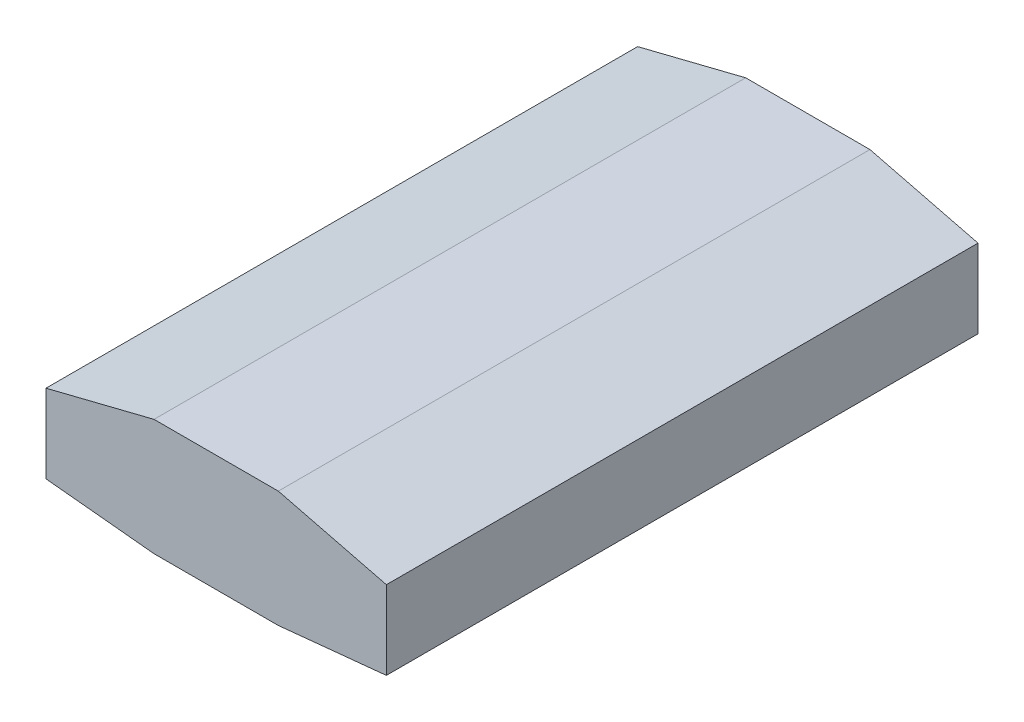
from build123d import *

# Parameters (mm, degrees)
SKETCH_1_W          = 63
SKETCH_1_H          = 21.54
EXTRUDE_1_DEPTH     = 109.5
CUT_EXTRUDE_1_DEPTH = 115.448647436
SKETCH_3_R          = 1
CUT_EXTRUDE_2_DEPTH = 5


with BuildPart() as part:
    # 草图1 → 凸台-拉伸1 (new body)
    with BuildSketch(Plane.XY):
        Rectangle(SKETCH_1_W, SKETCH_1_H)
    extrude(amount=EXTRUDE_1_DEPTH)

    # 草图2 → 切除-拉伸1 (cut, through all)
    with BuildSketch(Plane.XY.offset(109.5)):
        Polygon((11.5, 10.77), (31.5, 5.77), (31.5, 10.77), align=None)
        Polygon((-31.5, 10.77), (-11.5, 10.77), (-31.5, 5.77), align=None)
        Polygon((-31.5, -8.77), (-11.5, -10.77), (-31.5, -10.77), align=None)
        Polygon((31.5, -8.77), (11.5, -10.77), (31.5, -10.77), align=None)
    extrude(amount=-CUT_EXTRUDE_1_DEPTH, mode=Mode.SUBTRACT)

    # 草图3 → 切除-拉伸2 (cut)
    with BuildSketch(Plane.XZ.offset(10.77)):
        with Locations(Location((-7, 5, 0), (0, 0, 270))):
            Circle(SKETCH_3_R)
        with Locations(Location((7, 5, 0), (0, 0, 270))):
            Circle(SKETCH_3_R)
        with Locations(Location((-7, 85, 0), (0, 0, 270))):
            Circle(SKETCH_3_R)
        with Locations(Location((7, 85, 0), (0, 0, 270))):
            Circle(SKETCH_3_R)
    extrude(amount=-CUT_EXTRUDE_2_DEPTH, mode=Mode.SUBTRACT)


solid = part.part
